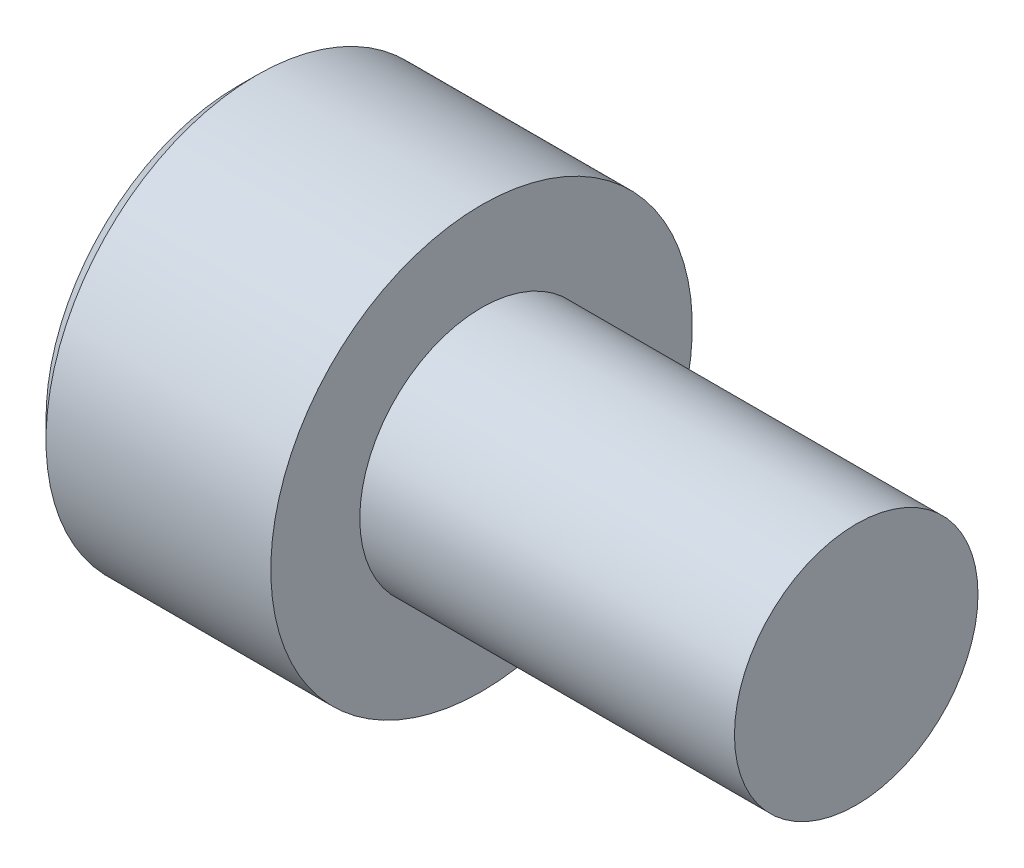
from build123d import *

# Parameters (mm, degrees)
CUT_EXTRUDE1_DEPTH = 1.1
CHAMFER1_SIZE      = 0.2


with BuildPart() as part:
    # Sketch1 → Revolve1 (revolve)
    with BuildSketch(Plane.XY, mode=Mode.PRIVATE) as revolve1_sk:
        Polygon((0, 1.3), (4, 1.3), (4, 0), (-2.6, 0), (-2.6, 2.25), (0, 2.25), align=None)
    revolve(revolve1_sk.sketch.rotate(Axis((-2.6, 0, 0), (1, 0, 0)), 180), axis=Axis((-2.6, 0, 0), (1, 0, 0)))

    # Sketch2 → Cut-Revolve1 (revolve, cut)
    with BuildSketch(Plane.XY, mode=Mode.PRIVATE) as cut_revolve1_sk:
        Polygon((-0.899139381, 0), (-1.5, 1), (-2.6, 1), (-2.6, 0), align=None)
    revolve(cut_revolve1_sk.sketch.rotate(Axis((-2.6, 0, 0), (1, 0, 0)), 180), axis=Axis((-2.6, 0, 0), (1, 0, 0)), mode=Mode.SUBTRACT)

    # Sketch3 → Cut-Extrude1 (cut)
    with BuildSketch(Plane.ZY.offset(2.6)):
        Polygon((1, 0.577350269), (0, 1.154700538), (-1, 0.577350269), (-1, -0.577350269), (0, -1.154700538), (1, -0.577350269), align=None)
    extrude(amount=-CUT_EXTRUDE1_DEPTH, mode=Mode.SUBTRACT)

    # Chamfer1
    chamfer1_edges = [part.edges().sort_by_distance(p)[0] for p in [
        (-2.6, 2.25, 0),
    ]]
    chamfer(chamfer1_edges, length=CHAMFER1_SIZE)


solid = part.part
